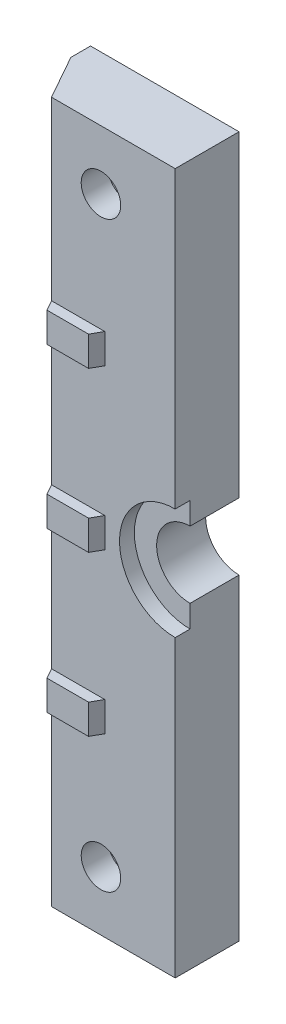
from build123d import *

# Parameters (mm, degrees)
BOSS_EXTRUDE1_DEPTH                              = 119.888
CBORE_FOR_1_4_SOCKET_HEAD_CAP_SCREW1_D           = 6.7564
CBORE_FOR_1_4_SOCKET_HEAD_CAP_SCREW1_CBORE_D     = 11.1125
CBORE_FOR_1_4_SOCKET_HEAD_CAP_SCREW1_CBORE_DEPTH = 6.35
SKETCH4_R                                        = 5.715
CUT_EXTRUDE1_DEPTH                               = 124.034883785
BOSS_EXTRUDE2_DEPTH                              = 2.54
LPATTERN1_COUNT                                  = 2
LPATTERN1_PITCH                                  = 27.2542
LPATTERN1_COL_COUNT                              = 2
LPATTERN1_COL_PITCH                              = 27.2542
SKETCH6_R                                        = 9.525
CUT_EXTRUDE2_DEPTH                               = 2.54


with BuildPart() as part:
    # Sketch1 → Boss-Extrude1 (new body)
    with BuildSketch(Plane(origin=(0, 0, 0), x_dir=(1, 0, 0), z_dir=(0, 1, 0))):
        Polygon((0, 0), (0, 10.922), (-25.4, 10.922), (-25.4, 7.5565), (-21.155673935, 0), align=None)
    extrude(amount=BOSS_EXTRUDE1_DEPTH)

    # CBORE for 1/4 Socket Head Cap Screw1 (through all)
    with Locations(Plane(origin=(0, 0, -10.922), x_dir=(-1, 0, 0), z_dir=(0, 0, -1))):
        with Locations((12.7, 109.77245), (12.7, 10.11555)):
            CounterBoreHole(CBORE_FOR_1_4_SOCKET_HEAD_CAP_SCREW1_D / 2, CBORE_FOR_1_4_SOCKET_HEAD_CAP_SCREW1_CBORE_D / 2, CBORE_FOR_1_4_SOCKET_HEAD_CAP_SCREW1_CBORE_DEPTH)

    # Sketch4 → Cut-Extrude1 (cut, through all)
    with BuildSketch(Plane(origin=(0, 0, -10.922), x_dir=(-1, 0, 0), z_dir=(0, 0, -1))):
        with Locations((0, 59.944)):
            Circle(SKETCH4_R)
    extrude(amount=-CUT_EXTRUDE1_DEPTH, mode=Mode.SUBTRACT)

    # Sketch5 → Boss-Extrude2 (add, symmetric)
    with BuildSketch(Plane(origin=(0, 59.944, 0), x_dir=(1, 0, 0), z_dir=(0, 1, 0))):
        Polygon((-21.155673935, 0), (-20.157008978, -1.778), (-13.045008978, -1.778), (-12.046344022, 0), align=None)
    boss_extrude2 = extrude(amount=BOSS_EXTRUDE2_DEPTH, both=True)

    # LPattern1: Boss-Extrude2 ×2
    with Locations(*[(0, -i * LPATTERN1_PITCH, 0) for i in range(1, LPATTERN1_COUNT)]):
        add(boss_extrude2)

    # LPattern1 col: Boss-Extrude2 ×2
    with Locations(*[(0, i * LPATTERN1_COL_PITCH, 0) for i in range(1, LPATTERN1_COL_COUNT)]):
        add(boss_extrude2)

    # Sketch6 → Cut-Extrude2 (cut)
    with BuildSketch(Plane.XY):
        with Locations((0, 59.944)):
            Circle(SKETCH6_R)
    extrude(amount=-CUT_EXTRUDE2_DEPTH, mode=Mode.SUBTRACT)


solid = part.part
